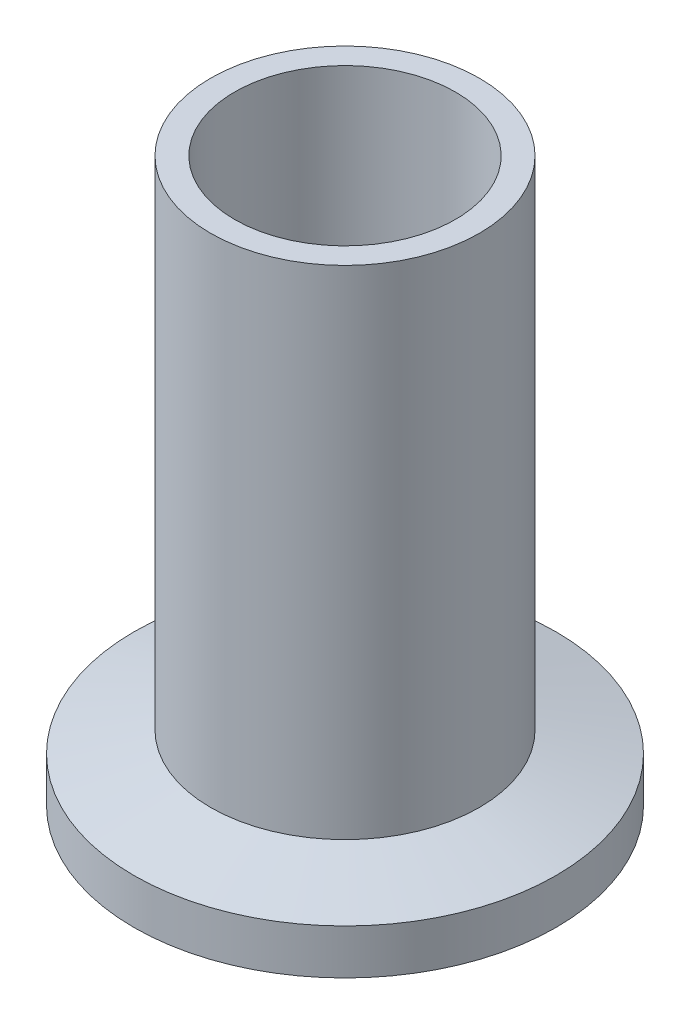
from build123d import *

# Parameters (mm, degrees)
SKETCH5_R     = 9.55
STUB_DEPTH    = 37.5
BORE_SKETCH_R = 7.85
BORE_DEPTH    = 46.276925691


with BuildPart() as part:
    # Sketch1 → Flange (revolve)
    with BuildSketch(Plane(origin=(0, 0, 0), x_dir=(0, 0, -1), z_dir=(1, 0, 0)), mode=Mode.PRIVATE) as flange_sk:
        Polygon((-15, 0), (-15, 3.2), (-6.789488223, 5.4), (0, 5.4), (0, 2.5), (-8.1, 2.5), (-8.1, 0), align=None)
    revolve(flange_sk.sketch.rotate(Axis((0, 0, 0), (0, 1, 0)), 180), axis=Axis((0, 0, 0), (0, 1, 0)))

    # Sketch5 → Stub (add)
    with BuildSketch(Plane.XZ.offset(-2.5)):
        with Locations(Location((0, 0, 0), (0, 0, 270))):
            Circle(SKETCH5_R)
    extrude(amount=-STUB_DEPTH)

    # Bore Sketch → Bore (cut, through all)
    with BuildSketch(Plane(origin=(0, 40, 0), x_dir=(1, 0, 0), z_dir=(0, 1, 0))):
        with Locations(Location((0, 0, 0), (0, 0, 270))):
            Circle(BORE_SKETCH_R)
    extrude(amount=-BORE_DEPTH, mode=Mode.SUBTRACT)


solid = part.part
